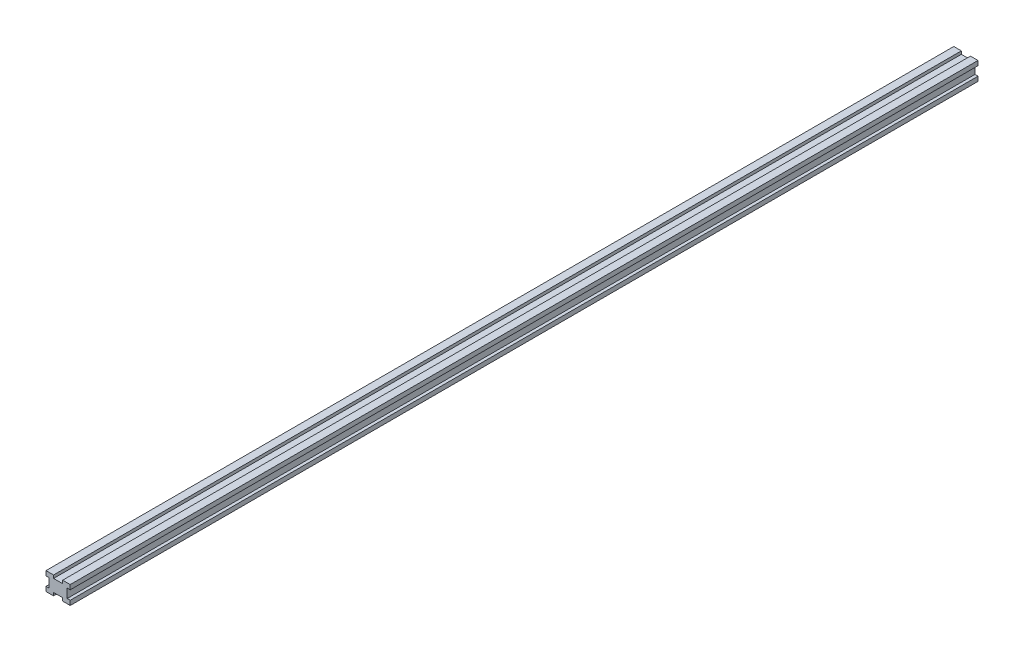
from build123d import *

# Parameters (mm, degrees)
SKETCH2_W           = 40
SKETCH2_H           = 30
BOSS_EXTRUDE2_DEPTH = 1500
SKETCH3_W           = 15
SKETCH3_H           = 5
SKETCH3_W_2         = 5
SKETCH3_H_2         = 15
CUT_EXTRUDE1_DEPTH  = 1500


with BuildPart() as part:
    # Sketch2 → Boss-Extrude2 (new body)
    with BuildSketch(Plane.XY):
        Rectangle(SKETCH2_W, SKETCH2_H)
    extrude(amount=BOSS_EXTRUDE2_DEPTH)

    # Sketch3 → Cut-Extrude1 (cut)
    with BuildSketch(Plane.XY.offset(1500)):
        with Locations((0, 12.5)):
            Rectangle(SKETCH3_W, SKETCH3_H)
        with Locations((17.5, 0)):
            Rectangle(SKETCH3_W_2, SKETCH3_H_2)
        with Locations((0, -12.5)):
            Rectangle(SKETCH3_W, SKETCH3_H)
        with Locations((-17.5, 0)):
            Rectangle(SKETCH3_W_2, SKETCH3_H_2)
    extrude(amount=-CUT_EXTRUDE1_DEPTH, mode=Mode.SUBTRACT)


solid = part.part
